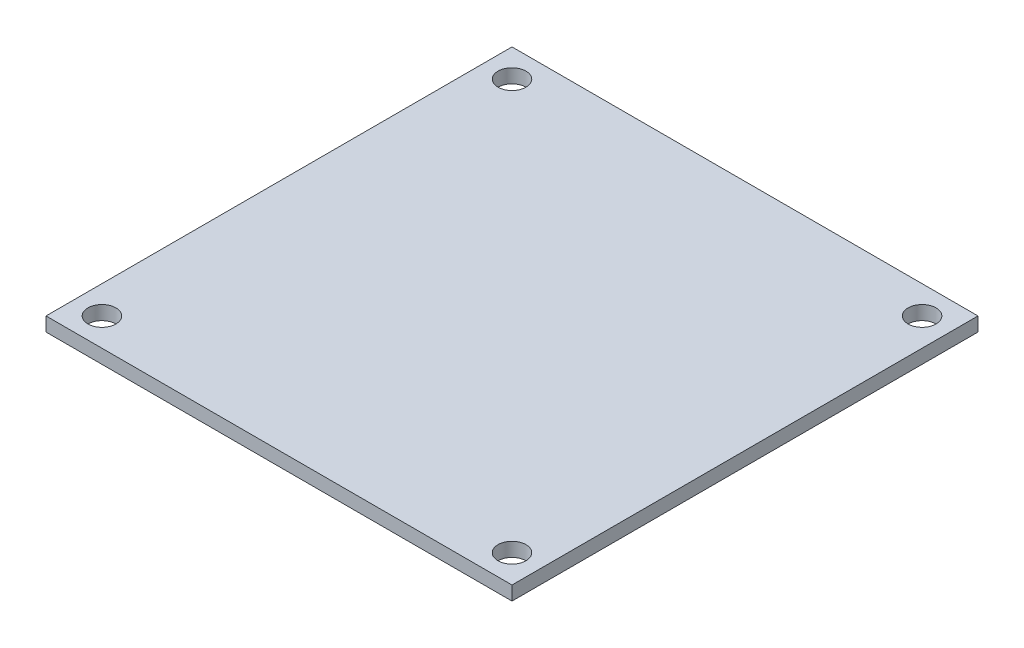
from build123d import *

# Parameters (mm, degrees)
SKETCH_1_W      = 50
SKETCH_1_H      = 50
SKETCH_1_R      = 1.5
EXTRUDE_1_DEPTH = 1.5


with BuildPart() as part:
    # 草图1 → 凸台-拉伸1 (new body)
    with BuildSketch(Plane(origin=(0, 0, 0), x_dir=(1, 0, 0), z_dir=(0, 1, 0))):
        Rectangle(SKETCH_1_W, SKETCH_1_H)
        with Locations(Location((-22, 22, 0), (0, 0, 270))):
            Circle(SKETCH_1_R, mode=Mode.SUBTRACT)
        with Locations(Location((22, 22, 0), (0, 0, 270))):
            Circle(SKETCH_1_R, mode=Mode.SUBTRACT)
        with Locations(Location((22, -22, 0), (0, 0, 90))):
            Circle(SKETCH_1_R, mode=Mode.SUBTRACT)
        with Locations(Location((-22, -22, 0), (0, 0, 90))):
            Circle(SKETCH_1_R, mode=Mode.SUBTRACT)
    extrude(amount=EXTRUDE_1_DEPTH)


solid = part.part
